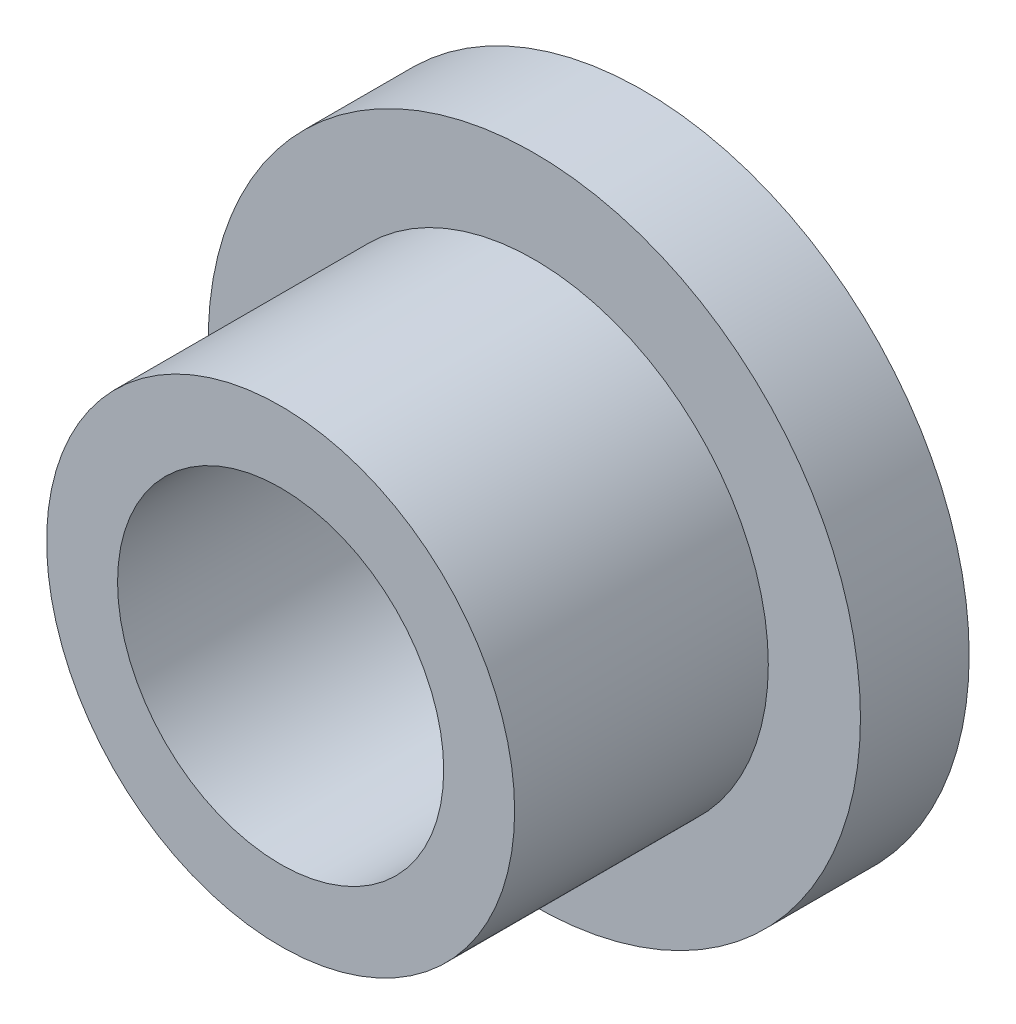
from build123d import *

# Parameters (mm, degrees)
SKETCH_1_R          = 9
SKETCH_1_R_2        = 4.5
EXTRUDE_1_DEPTH     = 10
CUT_EXTRUDE_START   = -7
SKETCH_2_R          = 9
SKETCH_2_R_2        = 6.457173098
CUT_EXTRUDE_1_DEPTH = 7


with BuildPart() as part:
    # Эскиз1 → Вытянуть1 (new body)
    with BuildSketch(Plane.XY):
        Circle(SKETCH_1_R)
        Circle(SKETCH_1_R_2, mode=Mode.SUBTRACT)
    extrude(amount=EXTRUDE_1_DEPTH)

    # Эскиз2 → Вырез-Вытянуть1 (cut)
    with BuildSketch(Plane.XY.offset(10).offset(CUT_EXTRUDE_START)):
        Circle(SKETCH_2_R)
        Circle(SKETCH_2_R_2, mode=Mode.SUBTRACT)
    extrude(amount=CUT_EXTRUDE_1_DEPTH, mode=Mode.SUBTRACT)


solid = part.part
